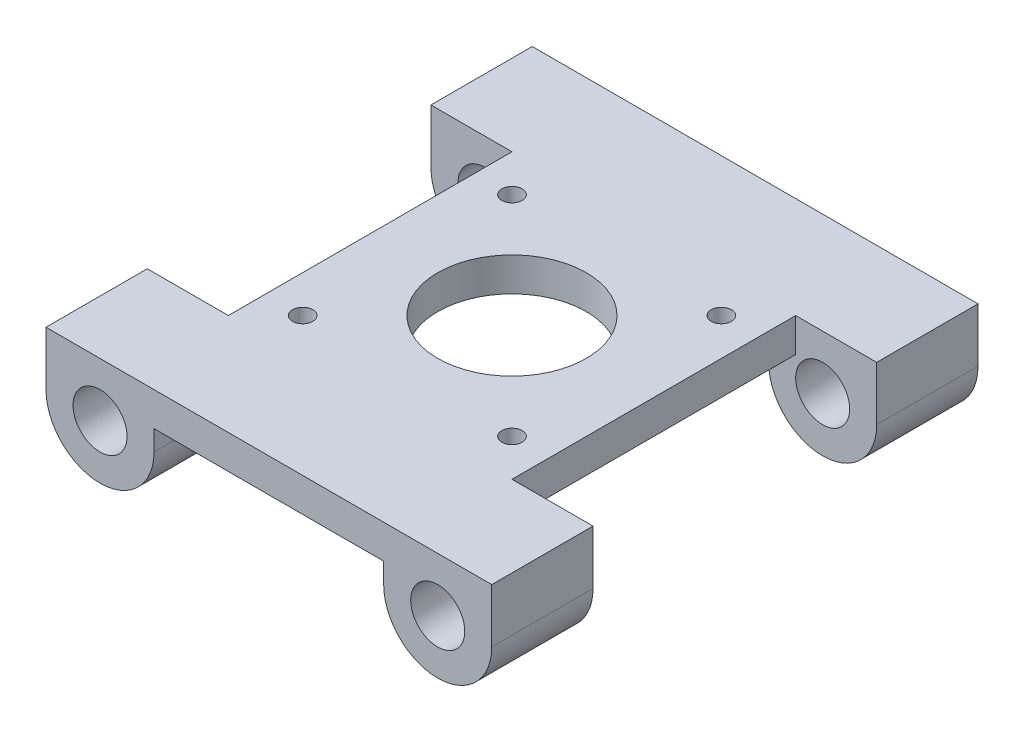
from build123d import *

# Parameters (mm, degrees)
SKETCH1_R           = 4
BOSS_EXTRUDE1_DEPTH = 15
SKETCH2_W           = 42
SKETCH2_H           = 5
BOSS_EXTRUDE2_DEPTH = 42
BOSS_EXTRUDE3_START = -57
SKETCH1_2_R         = 4
BOSS_EXTRUDE3_DEPTH = 15
SKETCH3_R           = 1.5
SKETCH3_R_2         = 11
CUT_EXTRUDE1_DEPTH  = 81.802227692


with BuildPart() as part:
    # Sketch1 → Boss-Extrude1 (new body)
    with BuildSketch(Plane.XY):
        with BuildLine():
            Line((33, 0), (-33, 0))
            Line((-33, 0), (-33, -8))
            ThreePointArc((-33, -8), (-25, -16), (-17, -8))
            Line((-17, -8), (-17, -5))
            Line((-17, -5), (17, -5))
            Line((17, -5), (17, -8))
            ThreePointArc((17, -8), (25, -16), (33, -8))
            Line((33, -8), (33, 0))
        make_face()
        with Locations((-25, -8)):
            Circle(SKETCH1_R, mode=Mode.SUBTRACT)
        with Locations(Location((25, -8, 0), (0, 0, 180))):
            Circle(SKETCH1_R, mode=Mode.SUBTRACT)
    extrude(amount=-BOSS_EXTRUDE1_DEPTH)

    # Sketch2 → Boss-Extrude2 (add)
    with BuildSketch(Plane(origin=(0, 0, -15), x_dir=(-1, 0, 0), z_dir=(0, 0, -1))):
        with Locations((0, -2.5)):
            Rectangle(SKETCH2_W, SKETCH2_H)
    extrude(amount=BOSS_EXTRUDE2_DEPTH)

    # Sketch1<2> → Boss-Extrude3 (add)
    with BuildSketch(Plane.XY.offset(BOSS_EXTRUDE3_START)):
        with BuildLine():
            Line((33, 0), (-33, 0))
            Line((-33, 0), (-33, -8))
            ThreePointArc((-33, -8), (-25, -16), (-17, -8))
            Line((-17, -8), (-17, -5))
            Line((-17, -5), (17, -5))
            Line((17, -5), (17, -8))
            ThreePointArc((17, -8), (25, -16), (33, -8))
            Line((33, -8), (33, 0))
        make_face()
        with Locations((-25, -8)):
            Circle(SKETCH1_2_R, mode=Mode.SUBTRACT)
        with Locations(Location((25, -8, 0), (0, 0, 180))):
            Circle(SKETCH1_2_R, mode=Mode.SUBTRACT)
    extrude(amount=-BOSS_EXTRUDE3_DEPTH)

    # Sketch3 → Cut-Extrude1 (cut, through all)
    with BuildSketch(Plane(origin=(0, 0, 0), x_dir=(1, 0, 0), z_dir=(0, 1, 0))):
        with Locations(Location((-15.5, 51.5, 0), (0, 0, 180))):
            Circle(SKETCH3_R)
        with Locations(Location((0, 36, 0), (0, 0, 180))):
            Circle(SKETCH3_R_2)
        with Locations(Location((15.5, 51.5, 0), (0, 0, 180))):
            Circle(SKETCH3_R)
        with Locations(Location((15.5, 20.5, 0), (0, 0, 180))):
            Circle(SKETCH3_R)
        with Locations(Location((-15.5, 20.5, 0), (0, 0, 180))):
            Circle(SKETCH3_R)
    extrude(amount=-CUT_EXTRUDE1_DEPTH, mode=Mode.SUBTRACT)


solid = part.part
